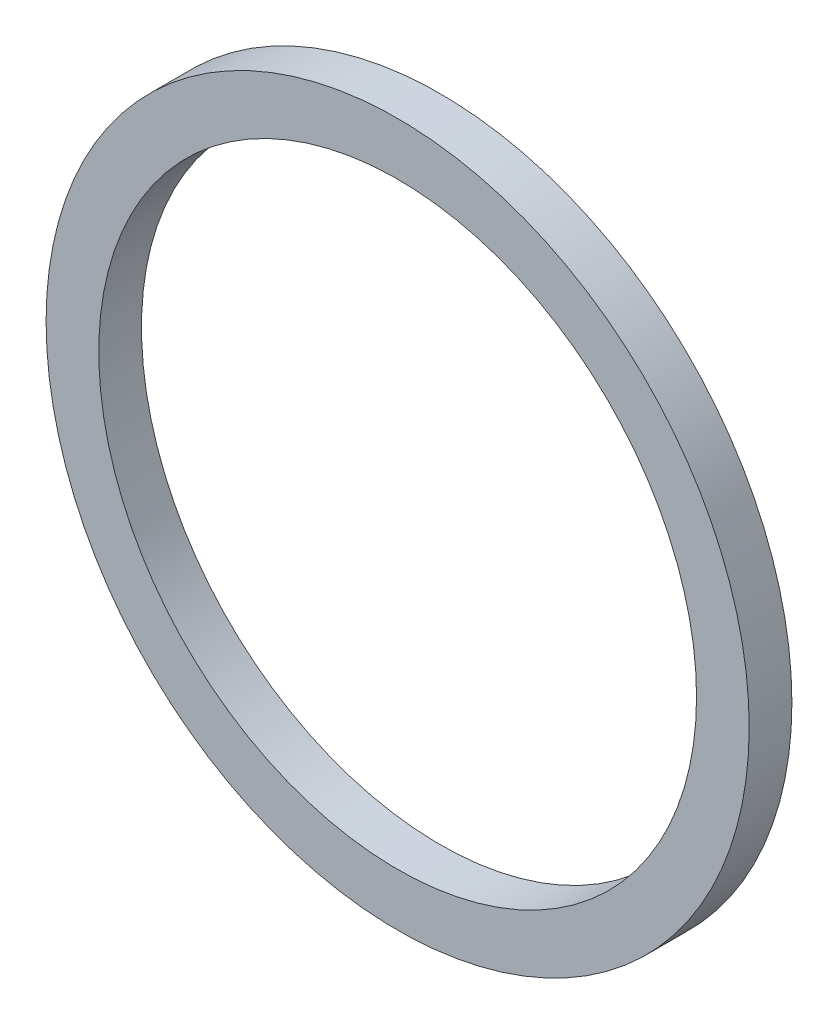
from build123d import *

# Parameters (mm, degrees)
SKETCH1_R           = 24.7
SKETCH1_R_2         = 21
BOSS_EXTRUDE1_DEPTH = 3


with BuildPart() as part:
    # Sketch1 → Boss-Extrude1 (new body)
    with BuildSketch(Plane.XY):
        Circle(SKETCH1_R)
        Circle(SKETCH1_R_2, mode=Mode.SUBTRACT)
    extrude(amount=BOSS_EXTRUDE1_DEPTH)


solid = part.part
